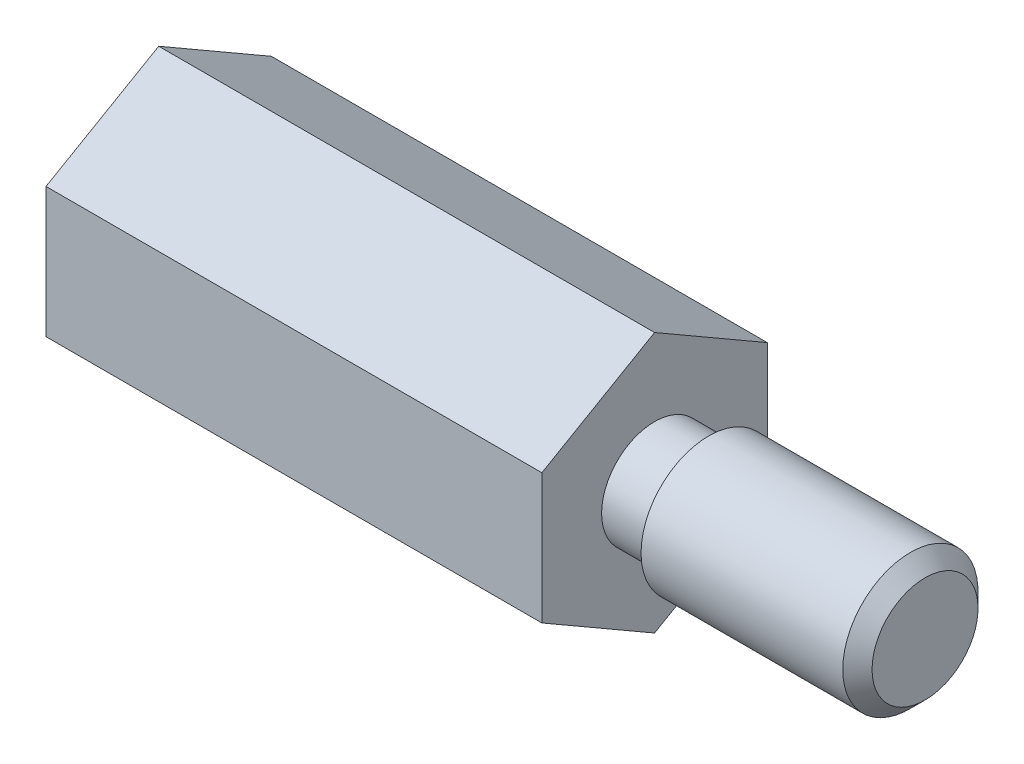
from build123d import *

# Parameters (mm, degrees)
BOSS_EXTRUDE1_DEPTH = 11
CHAMFER1_SIZE       = 0.325


with BuildPart() as part:
    # Sketch1 → Boss-Extrude1 (new body)
    with BuildSketch(Plane(origin=(0, 0, 0), x_dir=(0, -1, 0), z_dir=(-1, 0, 0))):
        Polygon((2.886751346, 0), (1.443375673, 2.5), (-1.443375673, 2.5), (-2.886751346, 0), (-1.443375673, -2.5), (1.443375673, -2.5), align=None)
    extrude(amount=-BOSS_EXTRUDE1_DEPTH)

    # Sketch2 → Cut-Revolve1 (revolve, cut)
    with BuildSketch(Plane.XY, mode=Mode.PRIVATE) as cut_revolve1_sk:
        Polygon((0, 1.229375), (0, 0), (9.999979987, 0), (9.2902, 1.229375), (8.270625, 1.229375), (8, 1.5), (8, 1.229375), align=None)
    revolve(cut_revolve1_sk.sketch.rotate(Axis((0, 0, 0), (1, 0, 0)), 270), axis=Axis((0, 0, 0), (1, 0, 0)), mode=Mode.SUBTRACT)

    # Sketch3 → Revolve1 (revolve)
    with BuildSketch(Plane(origin=(0, 0, 0), x_dir=(-1, 0, 0), z_dir=(0, 0, -1)), mode=Mode.PRIVATE) as revolve1_sk:
        Polygon((-17, 1.5), (-17, 0), (-11, 0), (-11, 1.175), (-12.2, 1.175), (-12.2, 1.5), align=None)
    revolve(revolve1_sk.sketch.rotate(Axis((17, 0, 0), (-1, 0, 0)), 270), axis=Axis((17, 0, 0), (-1, 0, 0)))

    # Chamfer1
    chamfer1_edges = [part.edges().sort_by_distance(p)[0] for p in [
        (0, 0, 1.229375),
        (17, 0, -1.5),
    ]]
    chamfer(chamfer1_edges, length=CHAMFER1_SIZE)


solid = part.part
